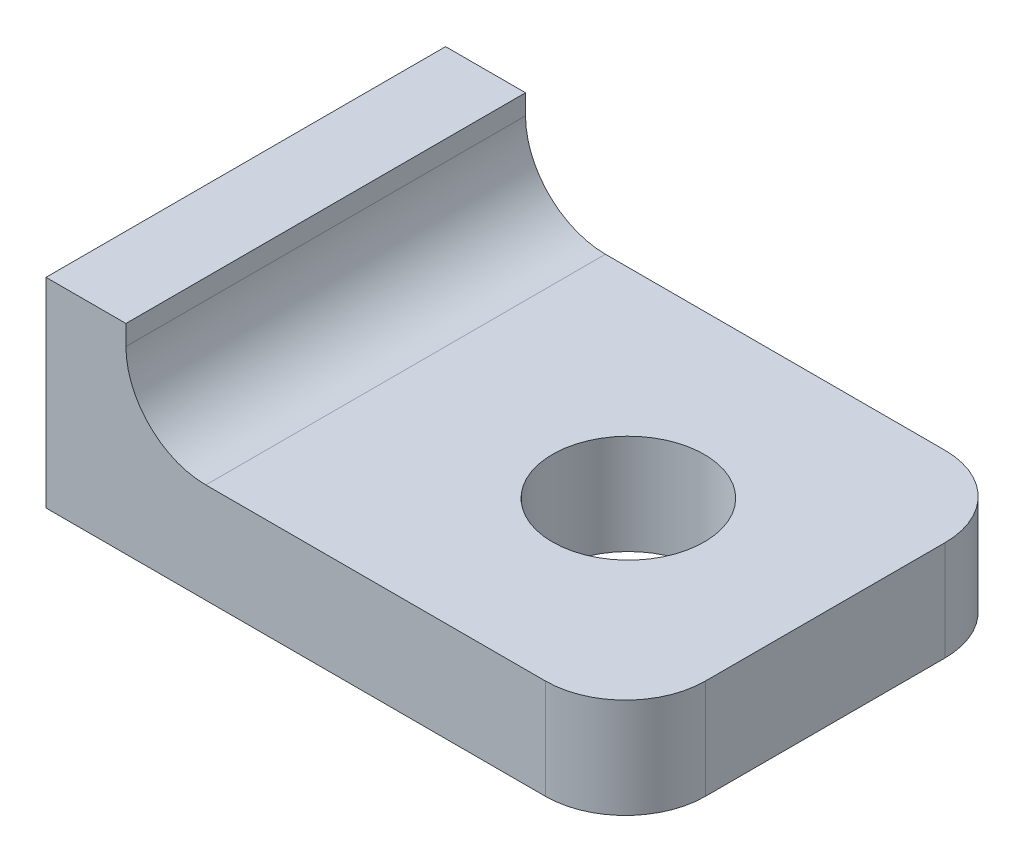
from build123d import *

# Parameters (mm, degrees)
SKETCH1_W           = 14.5
SKETCH1_H           = 10
BOSS_EXTRUDE1_DEPTH = 2.5
SKETCH2_R           = 1.9
CUT_EXTRUDE1_DEPTH  = 10.154916712
SKETCH3_W           = 2
SKETCH3_H           = 10
BOSS_EXTRUDE2_DEPTH = 2.5
FILLET1_R           = 2
FILLET2_R           = 2


with BuildPart() as part:
    # Sketch1 → Boss-Extrude1 (new body)
    with BuildSketch(Plane(origin=(0, 0, 0), x_dir=(1, 0, 0), z_dir=(0, 1, 0))):
        Rectangle(SKETCH1_W, SKETCH1_H)
    extrude(amount=BOSS_EXTRUDE1_DEPTH)

    # Sketch2 → Cut-Extrude1 (cut, through all)
    with BuildSketch(Plane(origin=(0, 2.5, 0), x_dir=(1, 0, 0), z_dir=(0, 1, 0))):
        with Locations(Location((2.323455921, 0, 0), (0, 0, 270))):
            Circle(SKETCH2_R)
    extrude(amount=-CUT_EXTRUDE1_DEPTH, mode=Mode.SUBTRACT)

    # Sketch3 → Boss-Extrude2 (add)
    with BuildSketch(Plane(origin=(0, 2.5, 0), x_dir=(1, 0, 0), z_dir=(0, 1, 0))):
        with Locations((-6.25, 0)):
            Rectangle(SKETCH3_W, SKETCH3_H)
    extrude(amount=BOSS_EXTRUDE2_DEPTH)

    # Fillet1
    fillet1_edges = [part.edges().sort_by_distance(p)[0] for p in [
        (-5.25, 2.5, 0),
    ]]
    fillet(fillet1_edges, radius=FILLET1_R)

    # Fillet2
    fillet2_edges = [part.edges().sort_by_distance(p)[0] for p in [
        (7.25, 1.25, 5),
        (7.25, 1.25, -5),
    ]]
    fillet(fillet2_edges, radius=FILLET2_R)


solid = part.part
